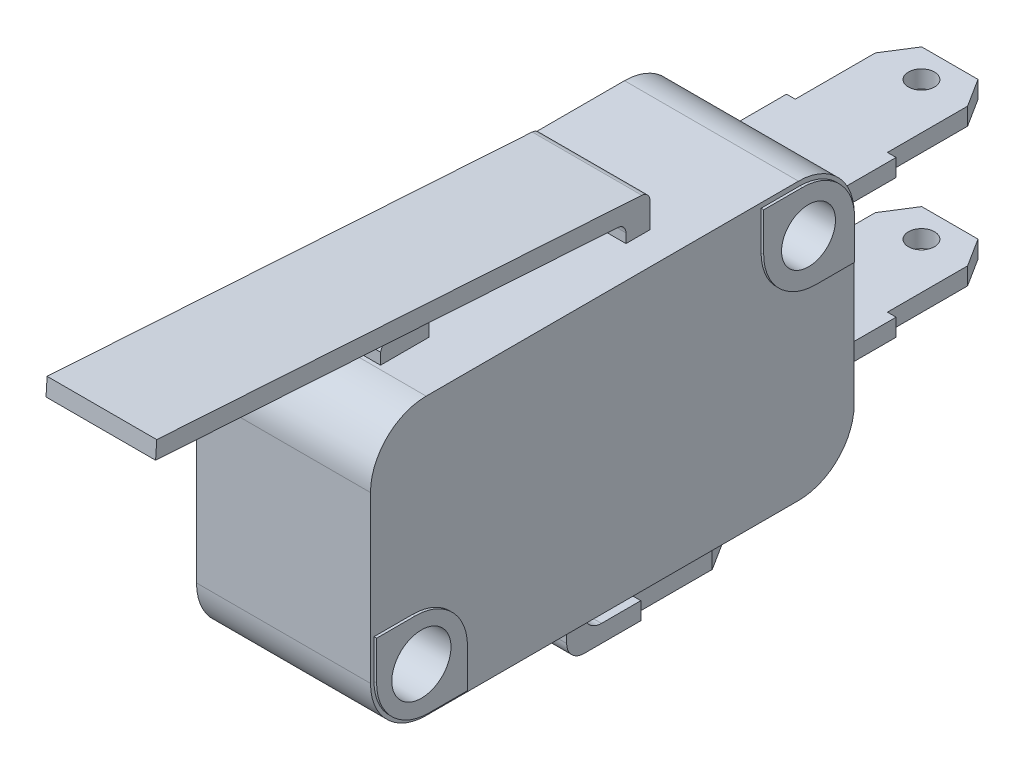
from build123d import *
from build123d.topology import SkipClean

# Parameters (mm, degrees)
BLOCOBASE_DEPTH           = 5
SKFIXACAO_R               = 1.7
SKFIXACAO_R_2             = 1.55
FIXACAO_DEPTH             = 5.15
RESSALTOFIXACAO_START     = 0.15
RESSALTOFIXACAO_DEPTH     = 0.15
BOTAO_DEPTH               = 2.15
SKETCH5_W                 = 6.3
SKETCH5_H                 = 1
BASECONECTORNONC_DEPTH    = 10.5
DESENHOCONECTORNONC_DEPTH = 20.5
BASECONECTORCOM_DEPTH     = 3.15
DESENHOCONECTORCOM_DEPTH  = 1
BASECONTATO_DEPTH         = 3.15
SKAPOIOROLO_R             = 0.7
APOIOROLO_DEPTH           = 1
SKROLO_R                  = 2.5
ROLO_DEPTH                = 4.3
SKETCH6_W                 = 15.037683952
SKETCH6_H                 = 10.848275608
CUT_EXTRUDE1_DEPTH        = 10
SKETCH7_W                 = 6.3
SKETCH7_H                 = 1
BOSS_EXTRUDE1_DEPTH       = 0.001


with BuildPart() as part:
    # skBlocoBase → BlocoBase (new, symmetric)
    with BuildSketch(Plane(origin=(0, 0, 0), x_dir=(0, 0, -1), z_dir=(1, 0, 0))):
        with BuildLine():
            Line((-10.7, 7.95), (10.7, 7.95))
            ThreePointArc((10.7, 7.95), (12.9627417, 7.0127417), (13.9, 4.75))
            Line((13.9, 4.75), (13.9, -4.75))
            ThreePointArc((13.9, -4.75), (12.9627417, -7.0127417), (10.7, -7.95))
            Line((10.7, -7.95), (-10.7, -7.95))
            ThreePointArc((-10.7, -7.95), (-12.9627417, -7.0127417), (-13.9, -4.75))
            Line((-13.9, -4.75), (-13.9, 4.75))
            ThreePointArc((-13.9, 4.75), (-12.9627417, 7.0127417), (-10.7, 7.95))
        make_face()
    extrude(amount=BLOCOBASE_DEPTH, both=True)

    # skFixacao → Fixacao (cut, symmetric)
    with BuildSketch(Plane(origin=(0, 0, 0), x_dir=(0, 0, -1), z_dir=(1, 0, 0))):
        with Locations((-11.125, -5.1)):
            Circle(SKFIXACAO_R)
        with Locations((11.125, 5.1)):
            Circle(SKFIXACAO_R_2)
    extrude(amount=FIXACAO_DEPTH, both=True, mode=Mode.SUBTRACT)

    # skRessaltoFixacao → RessaltoFixacao (add)
    # profile 1 of 2: a face of its own
    with SkipClean():  # the faces are left unmerged after this step: merging them gives an invalid solid
        with BuildSketch(Plane(origin=(5, 0, 0), x_dir=(0, 0, -1), z_dir=(1, 0, 0)).offset(RESSALTOFIXACAO_START)):
            with BuildLine():
                ThreePointArc((-8.475, -5.525), (-9.353679656, -3.403679656), (-11.475, -2.525))
                Line((-11.475, -2.525), (-13.7, -2.525))
                Line((-13.7, -2.525), (-13.7, -4.75))
                ThreePointArc((-13.7, -4.75), (-12.821320344, -6.871320344), (-10.7, -7.75))
                Line((-10.7, -7.75), (-8.475, -7.75))
                Line((-8.475, -7.75), (-8.475, -5.525))
            make_face()
            with BuildLine():
                ThreePointArc((-9.789845005, -6.152312282), (-10.474438165, -6.670595205), (-11.325, -6.788194302))
                ThreePointArc((-11.325, -6.788194302), (-11.775561835, -3.529404795), (-9.789845005, -6.152312282))
            make_face(mode=Mode.SUBTRACT)
        # profile 2 of 2: a face of its own
        with BuildSketch(Plane(origin=(5, 0, 0), x_dir=(0, 0, -1), z_dir=(1, 0, 0)).offset(RESSALTOFIXACAO_START)):
            with BuildLine():
                ThreePointArc((13.775, 4.675), (12.896320344, 6.796320344), (10.775, 7.675))
                Line((10.775, 7.675), (8.55, 7.675))
                Line((8.55, 7.675), (8.55, 5.45))
                ThreePointArc((8.55, 5.45), (9.428679656, 3.328679656), (11.55, 2.45))
                Line((11.55, 2.45), (13.775, 2.45))
                Line((13.775, 2.45), (13.775, 4.675))
            make_face()
            with BuildLine():
                ThreePointArc((12.353274612, 4.1545681), (11.71815932, 3.667986725), (10.925, 3.562957385))
                ThreePointArc((10.925, 3.562957385), (10.53184068, 6.532013275), (12.353274612, 4.1545681))
            make_face(mode=Mode.SUBTRACT)
        ressaltofixacao = extrude(amount=-RESSALTOFIXACAO_DEPTH)

    # MirrorRessaltoFixacao: RessaltoFixacao across plane
    with SkipClean():  # the faces are left unmerged after this step: merging them gives an invalid solid
        add(ressaltofixacao.mirror(Plane(origin=(0, 0, 0), x_dir=(0, 0, 1), z_dir=(1, 0, 0))))

    # skBotao → Botao (add, symmetric)
    with SkipClean():  # the faces are left unmerged after this step: merging them gives an invalid solid
        with BuildSketch(Plane(origin=(0, 0, 0), x_dir=(0, 0, -1), z_dir=(1, 0, 0))):
            with BuildLine():
                Line((-10.475, 7.95), (-10.475, 8.6))
                ThreePointArc((-10.475, 8.6), (-9.075, 9.6), (-7.675, 8.6))
                Line((-7.675, 8.6), (-7.675, 7.95))
                Line((-7.675, 7.95), (-10.475, 7.95))
            make_face()
        extrude(amount=BOTAO_DEPTH, both=True)

    # Sketch5 → BaseConectorNONC (add)
    with SkipClean():  # the faces are left unmerged after this step: merging them gives an invalid solid
        with BuildSketch(Plane(origin=(0, 0, -13.9), x_dir=(-1, 0, 0), z_dir=(0, 0, -1))):
            with Locations((0, -3.975)):
                Rectangle(SKETCH5_W, SKETCH5_H)
            with Locations((0, 3.975)):
                Rectangle(SKETCH5_W, SKETCH5_H)
        extrude(amount=BASECONECTORNONC_DEPTH)

    # skDesenhoConectorNONC → DesenhoConectorNONC (cut)
    with SkipClean():  # the faces are left unmerged after this step: merging them gives an invalid solid
        with BuildSketch(Plane.XZ.offset(4.475)):
            Polygon((2.65, -22.767142952), (1.616967042, -24.4), (3.15, -24.4), (3.15, -18.161236833), (2.65, -18.161236833), align=None)
            Polygon((-3.15, -24.4), (-1.616967042, -24.4), (-2.65, -22.767142952), (-2.65, -18.161236833), (-3.15, -18.161236833), align=None)
            with BuildLine():
                ThreePointArc((0, -22.017142952), (-0.75, -22.767142952), (0, -23.517142952))
                Line((0, -23.517142952), (0, -22.017142952))
            make_face()
            with BuildLine():
                Line((0, -22.017142952), (0, -23.517142952))
                ThreePointArc((0, -23.517142952), (0.530330086, -23.297473038), (0.75, -22.767142952))
                ThreePointArc((0.75, -22.767142952), (0.530330086, -22.236812866), (0, -22.017142952))
            make_face()
        extrude(amount=-DESENHOCONECTORNONC_DEPTH, mode=Mode.SUBTRACT)

    # skBaseConectorCOM → BaseConectorCOM (add, symmetric)
    with SkipClean():  # the faces are left unmerged after this step: merging them gives an invalid solid
        with BuildSketch(Plane(origin=(0, 0, 0), x_dir=(0, 0, -1), z_dir=(1, 0, 0))):
            with BuildLine():
                Line((9.725, -11.25), (0.225, -11.25))
                ThreePointArc((0.225, -11.25), (-0.482106781, -10.957106781), (-0.775, -10.25))
                Line((-0.775, -10.25), (-0.775, -7.95))
                Line((-0.775, -7.95), (0.225, -7.95))
                Line((0.225, -7.95), (0.225, -9.25))
                ThreePointArc((0.225, -9.25), (0.517893219, -9.957106781), (1.225, -10.25))
                Line((1.225, -10.25), (9.725, -10.25))
                Line((9.725, -10.25), (9.725, -11.25))
            make_face()
        extrude(amount=BASECONECTORCOM_DEPTH, both=True)

    # skDesenhoConectorCOM → DesenhoConectorCOM (cut)
    with SkipClean():  # the faces are left unmerged after this step: merging them gives an invalid solid
        with BuildSketch(Plane.XZ.offset(11.25)):
            Polygon((2.65, -8.092142952), (1.616967042, -9.725), (3.15, -9.725), (3.15, -3.486236833), (2.65, -3.486236833), align=None)
            with BuildLine():
                ThreePointArc((0, -7.342142952), (-0.75, -8.092142952), (0, -8.842142952))
                Line((0, -8.842142952), (0, -7.342142952))
            make_face()
            with BuildLine():
                Line((0, -7.342142952), (0, -8.842142952))
                ThreePointArc((0, -8.842142952), (0.530330086, -8.622473038), (0.75, -8.092142952))
                ThreePointArc((0.75, -8.092142952), (0.530330086, -7.561812866), (0, -7.342142952))
            make_face()
            Polygon((-3.15, -9.725), (-1.616967042, -9.725), (-2.65, -8.092142952), (-2.65, -3.486236833), (-3.15, -3.486236833), align=None)
        extrude(amount=-DESENHOCONECTORCOM_DEPTH, mode=Mode.SUBTRACT)

    # skBaseContato → BaseContato (add, symmetric)
    with SkipClean():  # the faces are left unmerged after this step: merging them gives an invalid solid
        with BuildSketch(Plane(origin=(0, 0, 0), x_dir=(0, 0, -1), z_dir=(1, 0, 0))):
            with BuildLine():
                Line((2.63302332, 7.95), (2.63302332, 8.486635004))
                ThreePointArc((2.63302332, 8.486635004), (2.497665983, 8.828739854), (2.164880406, 8.985619098))
                Line((2.164880406, 8.985619098), (-24.4, 10.681624431))
                Line((-24.4, 10.681624431), (-24.336285828, 11.679592619))
                Line((-24.336285828, 11.679592619), (3.545575005, 9.899506131))
                ThreePointArc((3.545575005, 9.899506131), (3.878360582, 9.742626887), (4.013717919, 9.400522037))
                Line((4.013717919, 9.400522037), (4.013717919, 7.95))
                Line((4.013717919, 7.95), (2.63302332, 7.95))
            make_face()
        extrude(amount=BASECONTATO_DEPTH, both=True)

    # skApoioRolo → ApoioRolo (add)
    with SkipClean():  # the faces are left unmerged after this step: merging them gives an invalid solid
        with BuildSketch(Plane(origin=(3.15, 0, 0), x_dir=(0, 0, -1), z_dir=(1, 0, 0))):
            with BuildLine():
                ThreePointArc((-21.354211514, 14.486814776), (-22.754211514, 15.886814776), (-24.154211514, 14.486814776))
                Line((-24.154211514, 14.486814776), (-24.336285828, 11.679592619))
                Line((-24.336285828, 11.679592619), (-22.939130364, 11.590392778))
                Line((-22.939130364, 11.590392778), (-21.541974901, 11.501192936))
                Line((-21.541974901, 11.501192936), (-21.365242034, 14.3114187))
                Line((-21.365242034, 14.3114187), (-21.354211514, 14.486814776))
            make_face()
            with Locations((-22.754211514, 14.486814776)):
                Circle(SKAPOIOROLO_R, mode=Mode.SUBTRACT)
        apoiorolo = extrude(amount=-APOIOROLO_DEPTH)

    # MirrorApoioRolo: ApoioRolo across plane
    with SkipClean():  # the faces are left unmerged after this step: merging them gives an invalid solid
        add(apoiorolo.mirror(Plane(origin=(0, 0, 0), x_dir=(0, 0, 1), z_dir=(1, 0, 0))))

    # skRolo → Rolo (add)
    with SkipClean():  # the faces are left unmerged after this step: merging them gives an invalid solid
        with BuildSketch(Plane.ZY.offset(-2.15)):
            with Locations(Location((22.754211514, 14.486814776, 0), (0, 0, 239.619073526))):
                Circle(SKROLO_R)
        extrude(amount=ROLO_DEPTH)

    # Sketch6 → Cut-Extrude1 (cut)
    with SkipClean():  # the faces are left unmerged after this step: merging them gives an invalid solid
        with BuildSketch(Plane(origin=(0, 10.084763511, -0.643850544), x_dir=(1, 0, 0), z_dir=(0, 0.9979681879895416, -0.06371417237060659))):
            with Locations((-4.368841976, -23.671158356)):
                Rectangle(SKETCH6_W, SKETCH6_H)
        extrude(amount=CUT_EXTRUDE1_DEPTH, mode=Mode.SUBTRACT)

    # Sketch7 → Boss-Extrude1 (add)
    with SkipClean():  # the faces are left unmerged after this step: merging them gives an invalid solid
        with BuildSketch(Plane(origin=(0, 1.594829108, 24.980136372), x_dir=(1, 0, 0), z_dir=(0, 0.06371417237060688, 0.9979681879895415))):
            with Locations((0, 9.605295572)):
                Rectangle(SKETCH7_W, SKETCH7_H)
        extrude(amount=BOSS_EXTRUDE1_DEPTH)


solid = part.part
